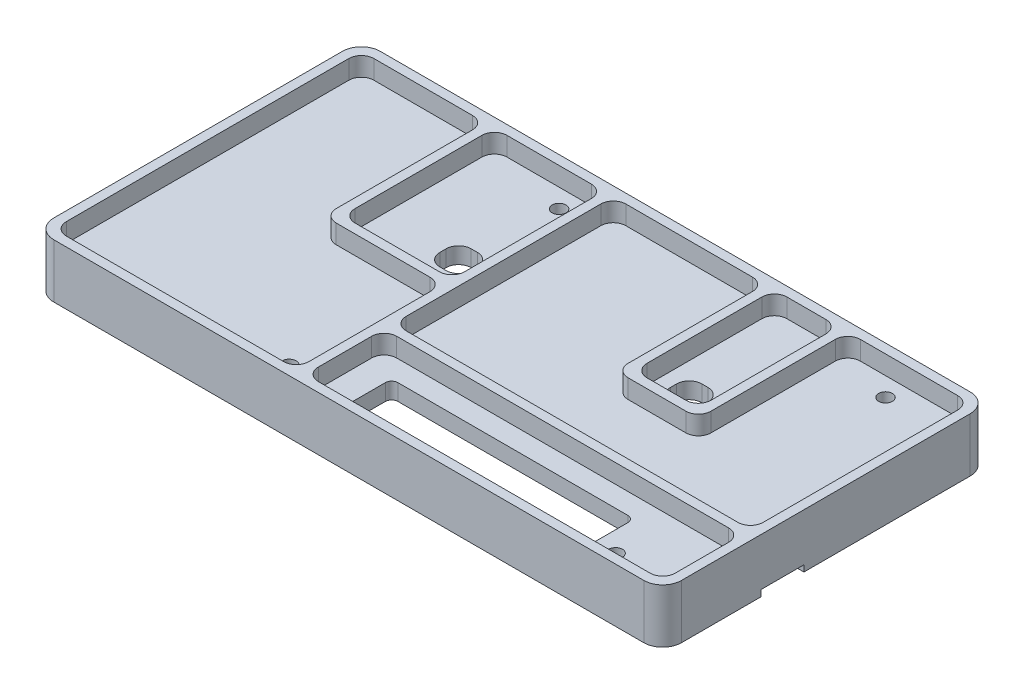
from build123d import *

# Parameters (mm, degrees)
SKETCH_1_W          = 100
SKETCH_1_H          = 52
EXTRUDE_1_DEPTH     = 8.6
SKETCH_2_W          = 97
SKETCH_2_H          = 49
CUT_EXTRUDE_1_DEPTH = 3
SKETCH_3_R          = 1.1
SKETCH_3_W          = 38.632034186
SKETCH_3_H          = 7.399361665
SKETCH_3_W_2        = 5
SKETCH_3_H_2        = 5
CUT_EXTRUDE_2_DEPTH = 61.603041755
FILLET_1_R          = 2
SKETCH_4_W          = 1.5
SKETCH_4_H          = 6.8
CUT_EXTRUDE_3_DEPTH = 1
SKETCH_5_W          = 97
SKETCH_5_H          = 49
CUT_EXTRUDE_4_DEPTH = 3
EXTRUDE_2_DEPTH     = 3
FILLET_2_R          = 3
FILLET_3_R          = 2
FILLET_5_R          = 1


with BuildPart() as part:
    # 草图1 → 凸台-拉伸1 (new body)
    with BuildSketch(Plane(origin=(0, 0, 0), x_dir=(1, 0, 0), z_dir=(0, 1, 0))):
        with Locations((1.17145908, 5.982033169)):
            Rectangle(SKETCH_1_W, SKETCH_1_H)
    extrude(amount=EXTRUDE_1_DEPTH)

    # 草图2 → 切除-拉伸1 (cut)
    with BuildSketch(Plane.XZ):
        with Locations((1.17145908, -5.982033169)):
            Rectangle(SKETCH_2_W, SKETCH_2_H)
    extrude(amount=-CUT_EXTRUDE_1_DEPTH, mode=Mode.SUBTRACT)

    # 草图3 → 切除-拉伸2 (cut, through all)
    with BuildSketch(Plane.XZ.offset(-3)):
        with Locations(Location((-12.82854092, 15.517966831, 0), (0, 0, 270))):
            Circle(SKETCH_3_R)
        with Locations(Location((39.17145908, 15.517966831, 0), (0, 0, 270))):
            Circle(SKETCH_3_R)
        with Locations(Location((39.17145908, -27.482033169, 0), (0, 0, 270))):
            Circle(SKETCH_3_R)
        with Locations(Location((-12.82854092, -27.482033169, 0), (0, 0, 270))):
            Circle(SKETCH_3_R)
        with Locations((16.615396969, 13.018709543)):
            Rectangle(SKETCH_3_W, SKETCH_3_H)
        with Locations((-13.82854092, -12.482033169)):
            Rectangle(SKETCH_3_W_2, SKETCH_3_H_2)
        with Locations((23.17145908, -12.21289677)):
            Rectangle(SKETCH_3_W_2, SKETCH_3_H_2)
    extrude(amount=-CUT_EXTRUDE_2_DEPTH, mode=Mode.SUBTRACT)

    # 圆角1
    fillet_1_edges = [part.edges().sort_by_distance(p)[0] for p in [
        (20.67145908, 5.8, -14.71289677),
        (20.67145908, 5.8, -9.71289677),
        (25.67145908, 5.8, -9.71289677),
        (25.67145908, 5.8, -14.71289677),
        (-16.32854092, 5.8, -14.982033169),
        (-16.32854092, 5.8, -9.982033169),
        (-11.32854092, 5.8, -9.982033169),
        (-11.32854092, 5.8, -14.982033169),
    ]]
    fillet(fillet_1_edges, radius=FILLET_1_R)

    # 草图4 → 切除-拉伸3 (cut)
    with BuildSketch(Plane.XZ):
        with Locations((50.42145908, 0.917966831)):
            Rectangle(SKETCH_4_W, SKETCH_4_H)
    extrude(amount=-CUT_EXTRUDE_3_DEPTH, mode=Mode.SUBTRACT)

    # 草图5 → 切除-拉伸4 (cut)
    with BuildSketch(Plane(origin=(0, 8.6, 0), x_dir=(1, 0, 0), z_dir=(0, 1, 0))):
        with Locations((1.17145908, 5.982033169)):
            Rectangle(SKETCH_5_W, SKETCH_5_H)
    extrude(amount=-CUT_EXTRUDE_4_DEPTH, mode=Mode.SUBTRACT)

    # 草图7 → 凸台-拉伸2 (add, through all)
    with BuildSketch(Plane(origin=(0, 5.6, 0), x_dir=(1, 0, 0), z_dir=(0, 1, 0))):
        Polygon((-8.68854092, -18.517966831), (-8.68854092, 4.782033169), (-27.62854092, 4.782033169), (-27.62854092, 30.482033169), (-26.12854092, 30.482033169), (-26.12854092, 6.282033169), (-8.68854092, 6.282033169), (-8.68854092, 30.482033169), (-7.18854092, 30.482033169), (-7.18854092, -4.517966831), (49.67145908, -4.517966831), (49.67145908, -6.017966831), (-7.18854092, -6.017966831), (-7.18854092, -18.517966831), align=None)
        Polygon((16.97145908, 30.482033169), (16.97145908, 6.682033169), (30.17145908, 6.682033169), (30.17145908, 30.482033169), (28.67145908, 30.482033169), (28.67145908, 8.182033169), (18.47145908, 8.182033169), (18.47145908, 30.482033169), align=None)
    extrude(amount=EXTRUDE_2_DEPTH)

    # 圆角2
    fillet_2_edges = [part.edges().sort_by_distance(p)[0] for p in [
        (-48.82854092, 4.3, -31.982033169),
        (51.17145908, 4.3, -31.982033169),
        (51.17145908, 4.3, 20.017966831),
        (-48.82854092, 4.3, 20.017966831),
    ]]
    fillet(fillet_2_edges, radius=FILLET_2_R)

    # 圆角3
    fillet_3_edges = [part.edges().sort_by_distance(p)[0] for p in [
        (49.67145908, 1.5, 18.517966831),
        (49.67145908, 1.5, -30.482033169),
        (-47.32854092, 1.5, -30.482033169),
        (-47.32854092, 1.5, 18.517966831),
        (-47.32854092, 7.1, 18.517966831),
        (-47.32854092, 7.1, -30.482033169),
        (49.67145908, 7.1, -30.482033169),
        (49.67145908, 7.1, 18.517966831),
        (-8.68854092, 7.1, 18.517966831),
        (-7.18854092, 7.1, 18.517966831),
        (-7.18854092, 7.1, 6.017966831),
        (49.67145908, 7.1, 6.017966831),
        (49.67145908, 7.1, 4.517966831),
        (-7.18854092, 7.1, 4.517966831),
        (-7.18854092, 7.1, -30.482033169),
        (-8.68854092, 7.1, -30.482033169),
        (-8.68854092, 7.1, -6.282033169),
        (-26.12854092, 7.1, -6.282033169),
        (-26.12854092, 7.1, -30.482033169),
        (-27.62854092, 7.1, -30.482033169),
        (-27.62854092, 7.1, -4.782033169),
        (-8.68854092, 7.1, -4.782033169),
        (18.47145908, 7.1, -30.482033169),
        (16.97145908, 7.1, -30.482033169),
        (16.97145908, 7.1, -6.682033169),
        (30.17145908, 7.1, -6.682033169),
        (30.17145908, 7.1, -30.482033169),
        (28.67145908, 7.1, -30.482033169),
        (28.67145908, 7.1, -8.182033169),
        (18.47145908, 7.1, -8.182033169),
    ]]
    fillet(fillet_3_edges, radius=FILLET_3_R)

    # 圆角5
    fillet_5_edges = [part.edges().sort_by_distance(p)[0] for p in [
        (-2.700620124, 4.3, 16.718390375),
        (35.931414062, 4.3, 16.718390375),
        (-2.700620124, 4.3, 9.31902871),
        (35.931414062, 4.3, 9.31902871),
    ]]
    fillet(fillet_5_edges, radius=FILLET_5_R)


solid = part.part
